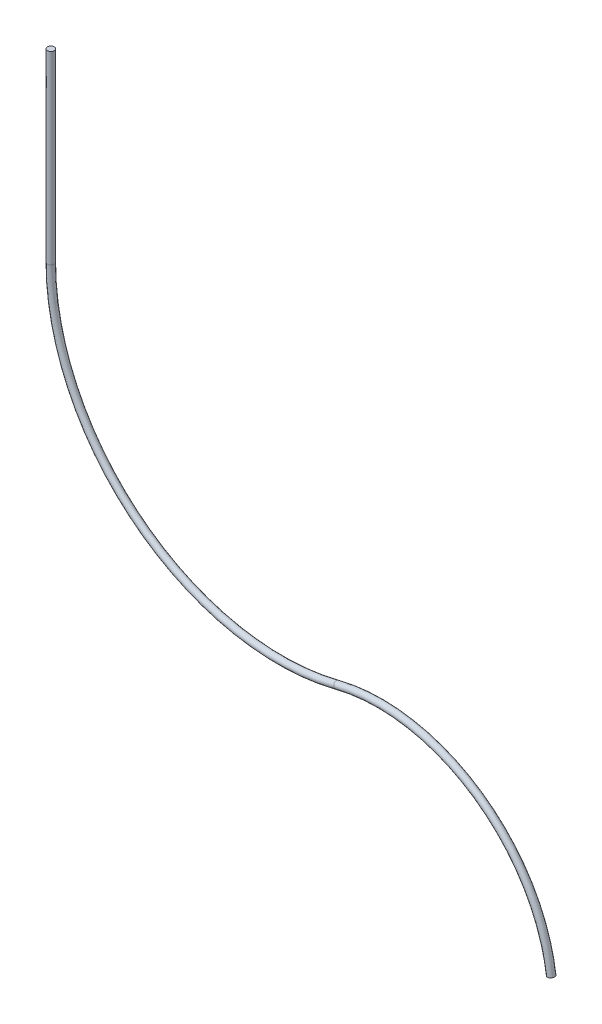
from build123d import *

# Parameters (mm, degrees)
SWEEP1_PROFILE_R = 4


with BuildPart() as part:
    # Sweep1: sweep along a path in Sketch1
    with BuildLine(Plane.XY) as sweep1_path:
        Line((0, 0), (0, -218.908393303))
        ThreePointArc((0, -218.908393303), (105.082488663, -433.72152748), (339.167787572, -482.620248049))
        ThreePointArc((339.167787572, -482.620248049), (504.341718041, -511.494674523), (592.493442577, -654.132093429))
    # Sweep1 profile (on start of the path) → Sweep1 (sweep)
    with BuildSketch(Plane(origin=(0, 0, 0), x_dir=(0, 0, -1), z_dir=(0, -1, 0))):
        Circle(SWEEP1_PROFILE_R)
    sweep(path=sweep1_path.line)


solid = part.part
